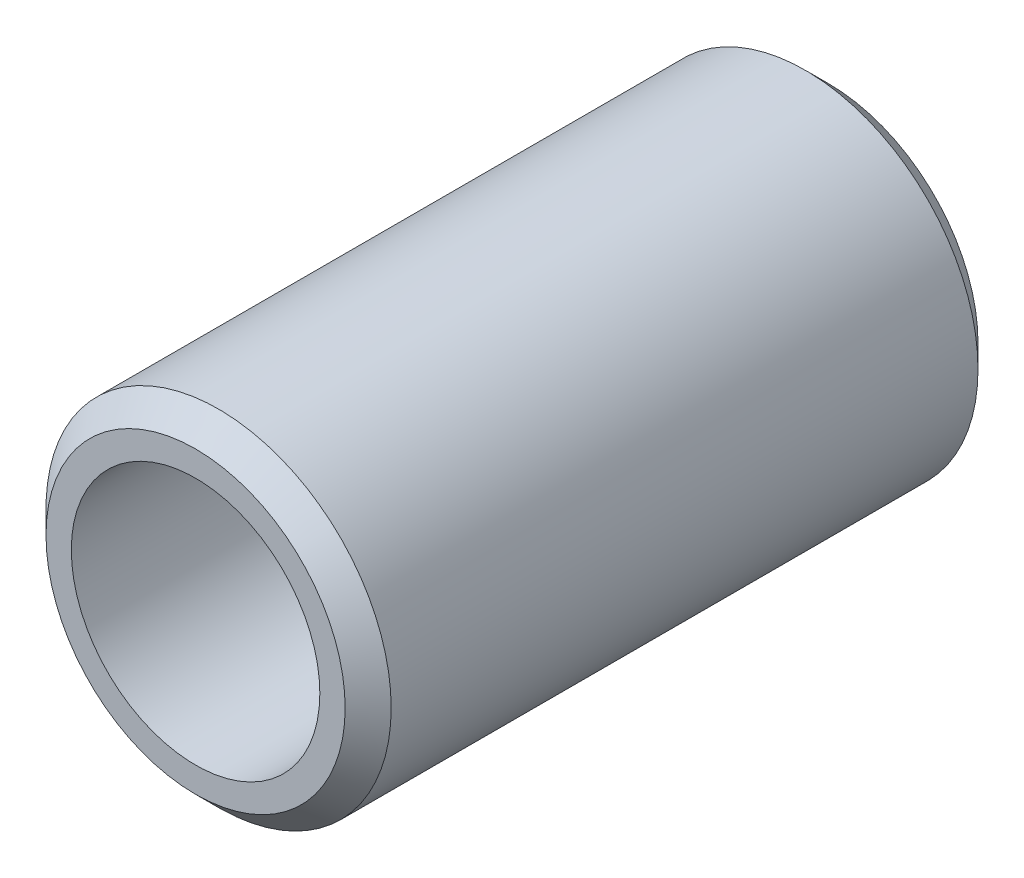
from build123d import *

# Parameters (mm, degrees)
SKETCH1_R           = 9.525
SKETCH1_R_2         = 6.858
BOSS_EXTRUDE1_DEPTH = 17.4625
CHAMFER1_SIZE       = 1.27


with BuildPart() as part:
    # Sketch1 → Boss-Extrude1 (new, symmetric)
    with BuildSketch(Plane.XY):
        Circle(SKETCH1_R)
        Circle(SKETCH1_R_2, mode=Mode.SUBTRACT)
    extrude(amount=BOSS_EXTRUDE1_DEPTH, both=True)

    # Chamfer1
    chamfer1_edges = [part.edges().sort_by_distance(p)[0] for p in [
        (-9.525, 0, -17.4625),
        (-9.525, 0, 17.4625),
    ]]
    chamfer(chamfer1_edges, length=CHAMFER1_SIZE)


solid = part.part
